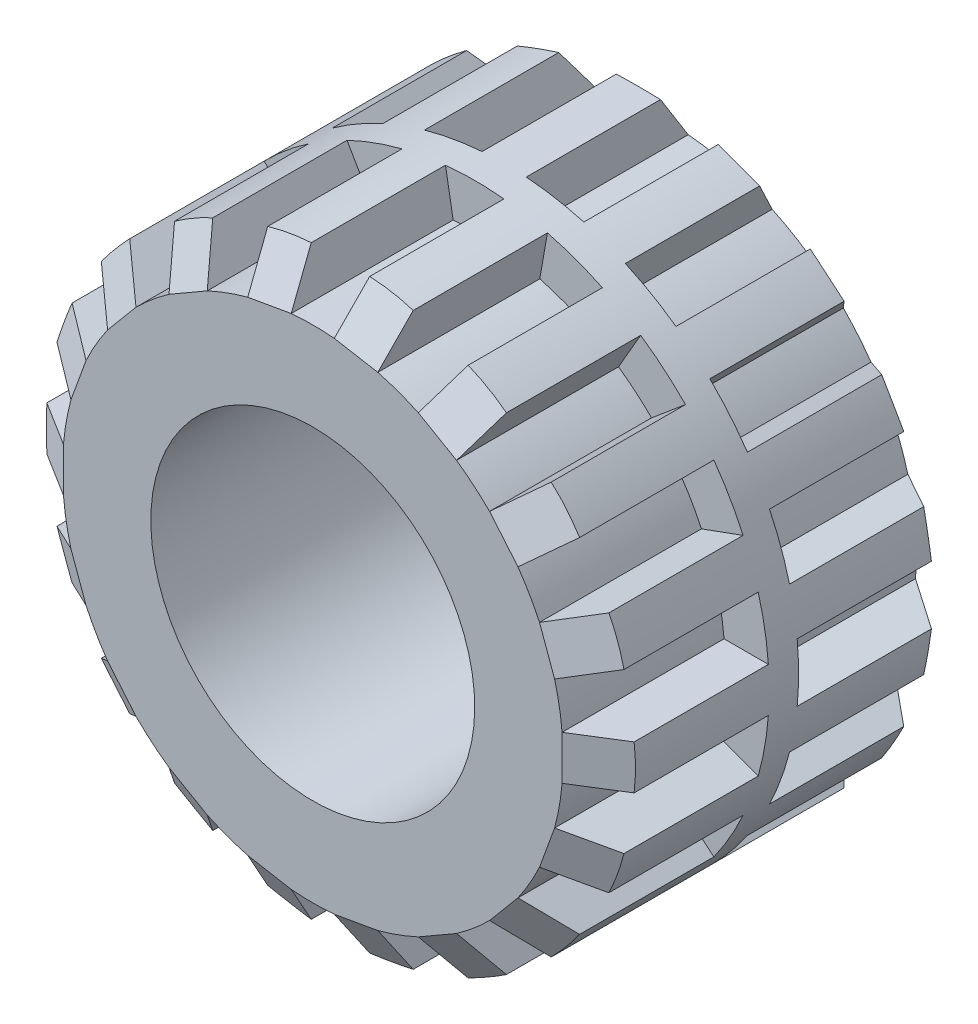
from build123d import *

# Parameters (mm, degrees)
SKETCH1_R             = 8.5
SKETCH1_R_2           = 5.5
BOSS_EXTRUDE1_DEPTH   = 6
SKETCH3_R             = 10
SKETCH3_R_2           = 8.5
BOSS_EXTRUDE3_DEPTH   = 0.5
BOSS_EXTRUDE4_DEPTH   = 5.5
CUT_EXTRUDE1_DEPTH    = 1.5
CIRPATTERN1_COUNT     = 18
MIRROR1_COPY_1_DEPTH  = 5.5
MIRROR1_COPY_2_DEPTH  = 5.5
MIRROR1_COPY_3_DEPTH  = 5.5
MIRROR1_COPY_4_DEPTH  = 5.5
MIRROR1_COPY_5_DEPTH  = 5.5
MIRROR1_COPY_6_DEPTH  = 5.5
MIRROR1_COPY_7_DEPTH  = 5.5
MIRROR1_COPY_8_DEPTH  = 5.5
MIRROR1_COPY_9_DEPTH  = 5.5
MIRROR1_COPY_10_DEPTH = 5.5
MIRROR1_COPY_11_DEPTH = 5.5
MIRROR1_COPY_12_DEPTH = 5.5
MIRROR1_COPY_13_DEPTH = 5.5
MIRROR1_COPY_14_DEPTH = 5.5
MIRROR1_COPY_15_DEPTH = 5.5
MIRROR1_COPY_16_DEPTH = 5.5
MIRROR1_COPY_17_DEPTH = 5.5
MIRROR1_COPY_18_DEPTH = 1.5
MIRROR1_COPY_19_DEPTH = 1.5
MIRROR1_COPY_20_DEPTH = 1.5
MIRROR1_COPY_21_DEPTH = 1.5
MIRROR1_COPY_22_DEPTH = 1.5
MIRROR1_COPY_23_DEPTH = 1.5
MIRROR1_COPY_24_DEPTH = 1.5
MIRROR1_COPY_25_DEPTH = 1.5
MIRROR1_COPY_26_DEPTH = 1.5
MIRROR1_COPY_27_DEPTH = 1.5
MIRROR1_COPY_28_DEPTH = 1.5
MIRROR1_COPY_29_DEPTH = 1.5
MIRROR1_COPY_30_DEPTH = 1.5
MIRROR1_COPY_31_DEPTH = 1.5
MIRROR1_COPY_32_DEPTH = 1.5
MIRROR1_COPY_33_DEPTH = 1.5
MIRROR1_COPY_34_DEPTH = 1.5
BODY_MOVE_COPY1_ANGLE = 10


with BuildPart() as part:
    # Sketch1 → Boss-Extrude1 (new, symmetric)
    with BuildSketch(Plane.XY):
        Circle(SKETCH1_R)
        Circle(SKETCH1_R_2, mode=Mode.SUBTRACT)
    extrude(amount=BOSS_EXTRUDE1_DEPTH, both=True)

    # Sketch3 → Boss-Extrude3 (add, symmetric)
    with BuildSketch(Plane.XY):
        Circle(SKETCH3_R)
        Circle(SKETCH3_R_2, mode=Mode.SUBTRACT)
    extrude(amount=BOSS_EXTRUDE3_DEPTH, both=True)

    # Sketch4 → Boss-Extrude4 (add)
    with BuildSketch(Plane(origin=(0, 0, -0.5), x_dir=(-1, 0, 0), z_dir=(0, 0, -1))):
        with BuildLine():
            Line((-0.75, 8.466847111), (-0.75, 9.971835338))
            ThreePointArc((-0.75, 9.971835338), (0, 10), (0.75, 9.971835338))
            Line((0.75, 9.971835338), (0.75, 8.466847111))
            ThreePointArc((0.75, 8.466847111), (0, 8.5), (-0.75, 8.466847111))
        make_face()
    boss_extrude4 = extrude(amount=BOSS_EXTRUDE4_DEPTH)

    # Sketch5 → Cut-Extrude1 (cut)
    with BuildSketch(Plane.ZY.offset(0.75)):
        Polygon((-6, 8.466847111), (-5, 10.066847111), (-6, 10.066847111), align=None)
    cut_extrude1 = extrude(amount=-CUT_EXTRUDE1_DEPTH, mode=Mode.SUBTRACT)

    # CirPattern1: Boss-Extrude4, Cut-Extrude1 ×18 about axis
    cirpattern1_axis = Axis((0, 0, 0), (0, 0, 1))
    add([boss_extrude4.rotate(cirpattern1_axis, i * 360 / CIRPATTERN1_COUNT) for i in range(1, CIRPATTERN1_COUNT)])
    add([cut_extrude1.rotate(cirpattern1_axis, i * 360 / CIRPATTERN1_COUNT) for i in range(1, CIRPATTERN1_COUNT)], mode=Mode.SUBTRACT)

    # Mirror1: Boss-Extrude4, Cut-Extrude1 across plane
    add(boss_extrude4.mirror(Plane.XY))
    add(cut_extrude1.mirror(Plane.XY), mode=Mode.SUBTRACT)

    # Mirror1 copy 1 sketch → Mirror1 copy 1 (add)
    with BuildSketch(Plane(origin=(0, 0, 0.5), x_dir=(-0.9396926207859084, -0.3420201433256687, 0), z_dir=(0, 0, 1))):
        with BuildLine():
            Line((-0.75, -8.466847111), (-0.75, -9.971835338))
            ThreePointArc((-0.75, -9.971835338), (0, -10), (0.75, -9.971835338))
            Line((0.75, -9.971835338), (0.75, -8.466847111))
            ThreePointArc((0.75, -8.466847111), (0, -8.5), (-0.75, -8.466847111))
        make_face()
    extrude(amount=MIRROR1_COPY_1_DEPTH)

    # Mirror1 copy 2 sketch → Mirror1 copy 2 (add)
    with BuildSketch(Plane(origin=(0, 0, 0.5), x_dir=(-0.766044443118978, -0.6427876096865393, 0), z_dir=(0, 0, 1))):
        with BuildLine():
            Line((-0.75, -8.466847111), (-0.75, -9.971835338))
            ThreePointArc((-0.75, -9.971835338), (0, -10), (0.75, -9.971835338))
            Line((0.75, -9.971835338), (0.75, -8.466847111))
            ThreePointArc((0.75, -8.466847111), (0, -8.5), (-0.75, -8.466847111))
        make_face()
    extrude(amount=MIRROR1_COPY_2_DEPTH)

    # Mirror1 copy 3 sketch → Mirror1 copy 3 (add)
    with BuildSketch(Plane(origin=(0, 0, 0.5), x_dir=(-0.5000000000000001, -0.8660254037844386, 0), z_dir=(0, 0, 1))):
        with BuildLine():
            Line((-0.75, -8.466847111), (-0.75, -9.971835338))
            ThreePointArc((-0.75, -9.971835338), (0, -10), (0.75, -9.971835338))
            Line((0.75, -9.971835338), (0.75, -8.466847111))
            ThreePointArc((0.75, -8.466847111), (0, -8.5), (-0.75, -8.466847111))
        make_face()
    extrude(amount=MIRROR1_COPY_3_DEPTH)

    # Mirror1 copy 4 sketch → Mirror1 copy 4 (add)
    with BuildSketch(Plane(origin=(0, 0, 0.5), x_dir=(-0.17364817766693041, -0.984807753012208, 0), z_dir=(0, 0, 1))):
        with BuildLine():
            Line((-0.75, -8.466847111), (-0.75, -9.971835338))
            ThreePointArc((-0.75, -9.971835338), (0, -10), (0.75, -9.971835338))
            Line((0.75, -9.971835338), (0.75, -8.466847111))
            ThreePointArc((0.75, -8.466847111), (0, -8.5), (-0.75, -8.466847111))
        make_face()
    extrude(amount=MIRROR1_COPY_4_DEPTH)

    # Mirror1 copy 5 sketch → Mirror1 copy 5 (add)
    with BuildSketch(Plane(origin=(0, 0, 0.5), x_dir=(0.1736481776669303, -0.984807753012208, 0), z_dir=(0, 0, 1))):
        with BuildLine():
            Line((-0.75, -8.466847111), (-0.75, -9.971835338))
            ThreePointArc((-0.75, -9.971835338), (0, -10), (0.75, -9.971835338))
            Line((0.75, -9.971835338), (0.75, -8.466847111))
            ThreePointArc((0.75, -8.466847111), (0, -8.5), (-0.75, -8.466847111))
        make_face()
    extrude(amount=MIRROR1_COPY_5_DEPTH)

    # Mirror1 copy 6 sketch → Mirror1 copy 6 (add)
    with BuildSketch(Plane(origin=(0, 0, 0.5), x_dir=(0.4999999999999998, -0.8660254037844387, 0), z_dir=(0, 0, 1))):
        with BuildLine():
            Line((-0.75, -8.466847111), (-0.75, -9.971835338))
            ThreePointArc((-0.75, -9.971835338), (0, -10), (0.75, -9.971835338))
            Line((0.75, -9.971835338), (0.75, -8.466847111))
            ThreePointArc((0.75, -8.466847111), (0, -8.5), (-0.75, -8.466847111))
        make_face()
    extrude(amount=MIRROR1_COPY_6_DEPTH)

    # Mirror1 copy 7 sketch → Mirror1 copy 7 (add)
    with BuildSketch(Plane(origin=(0, 0, 0.5), x_dir=(0.7660444431189779, -0.6427876096865395, 0), z_dir=(0, 0, 1))):
        with BuildLine():
            Line((-0.75, -8.466847111), (-0.75, -9.971835338))
            ThreePointArc((-0.75, -9.971835338), (0, -10), (0.75, -9.971835338))
            Line((0.75, -9.971835338), (0.75, -8.466847111))
            ThreePointArc((0.75, -8.466847111), (0, -8.5), (-0.75, -8.466847111))
        make_face()
    extrude(amount=MIRROR1_COPY_7_DEPTH)

    # Mirror1 copy 8 sketch → Mirror1 copy 8 (add)
    with BuildSketch(Plane(origin=(0, 0, 0.5), x_dir=(0.9396926207859083, -0.3420201433256689, 0), z_dir=(0, 0, 1))):
        with BuildLine():
            Line((-0.75, -8.466847111), (-0.75, -9.971835338))
            ThreePointArc((-0.75, -9.971835338), (0, -10), (0.75, -9.971835338))
            Line((0.75, -9.971835338), (0.75, -8.466847111))
            ThreePointArc((0.75, -8.466847111), (0, -8.5), (-0.75, -8.466847111))
        make_face()
    extrude(amount=MIRROR1_COPY_8_DEPTH)

    # Mirror1 copy 9 sketch → Mirror1 copy 9 (add)
    with BuildSketch(Plane.XY.offset(0.5)):
        with BuildLine():
            Line((-0.75, -8.466847111), (-0.75, -9.971835338))
            ThreePointArc((-0.75, -9.971835338), (0, -10), (0.75, -9.971835338))
            Line((0.75, -9.971835338), (0.75, -8.466847111))
            ThreePointArc((0.75, -8.466847111), (0, -8.5), (-0.75, -8.466847111))
        make_face()
    extrude(amount=MIRROR1_COPY_9_DEPTH)

    # Mirror1 copy 10 sketch → Mirror1 copy 10 (add)
    with BuildSketch(Plane(origin=(0, 0, 0.5), x_dir=(0.9396926207859084, 0.34202014332566866, 0), z_dir=(0, 0, 1))):
        with BuildLine():
            Line((-0.75, -8.466847111), (-0.75, -9.971835338))
            ThreePointArc((-0.75, -9.971835338), (0, -10), (0.75, -9.971835338))
            Line((0.75, -9.971835338), (0.75, -8.466847111))
            ThreePointArc((0.75, -8.466847111), (0, -8.5), (-0.75, -8.466847111))
        make_face()
    extrude(amount=MIRROR1_COPY_10_DEPTH)

    # Mirror1 copy 11 sketch → Mirror1 copy 11 (add)
    with BuildSketch(Plane(origin=(0, 0, 0.5), x_dir=(0.766044443118978, 0.6427876096865393, 0), z_dir=(0, 0, 1))):
        with BuildLine():
            Line((-0.75, -8.466847111), (-0.75, -9.971835338))
            ThreePointArc((-0.75, -9.971835338), (0, -10), (0.75, -9.971835338))
            Line((0.75, -9.971835338), (0.75, -8.466847111))
            ThreePointArc((0.75, -8.466847111), (0, -8.5), (-0.75, -8.466847111))
        make_face()
    extrude(amount=MIRROR1_COPY_11_DEPTH)

    # Mirror1 copy 12 sketch → Mirror1 copy 12 (add)
    with BuildSketch(Plane(origin=(0, 0, 0.5), x_dir=(0.5000000000000004, 0.8660254037844384, 0), z_dir=(0, 0, 1))):
        with BuildLine():
            Line((-0.75, -8.466847111), (-0.75, -9.971835338))
            ThreePointArc((-0.75, -9.971835338), (0, -10), (0.75, -9.971835338))
            Line((0.75, -9.971835338), (0.75, -8.466847111))
            ThreePointArc((0.75, -8.466847111), (0, -8.5), (-0.75, -8.466847111))
        make_face()
    extrude(amount=MIRROR1_COPY_12_DEPTH)

    # Mirror1 copy 13 sketch → Mirror1 copy 13 (add)
    with BuildSketch(Plane(origin=(0, 0, 0.5), x_dir=(0.17364817766693033, 0.984807753012208, 0), z_dir=(0, 0, 1))):
        with BuildLine():
            Line((-0.75, -8.466847111), (-0.75, -9.971835338))
            ThreePointArc((-0.75, -9.971835338), (0, -10), (0.75, -9.971835338))
            Line((0.75, -9.971835338), (0.75, -8.466847111))
            ThreePointArc((0.75, -8.466847111), (0, -8.5), (-0.75, -8.466847111))
        make_face()
    extrude(amount=MIRROR1_COPY_13_DEPTH)

    # Mirror1 copy 14 sketch → Mirror1 copy 14 (add)
    with BuildSketch(Plane(origin=(0, 0, 0.5), x_dir=(-0.17364817766692997, 0.9848077530122081, 0), z_dir=(0, 0, 1))):
        with BuildLine():
            Line((-0.75, -8.466847111), (-0.75, -9.971835338))
            ThreePointArc((-0.75, -9.971835338), (0, -10), (0.75, -9.971835338))
            Line((0.75, -9.971835338), (0.75, -8.466847111))
            ThreePointArc((0.75, -8.466847111), (0, -8.5), (-0.75, -8.466847111))
        make_face()
    extrude(amount=MIRROR1_COPY_14_DEPTH)

    # Mirror1 copy 15 sketch → Mirror1 copy 15 (add)
    with BuildSketch(Plane(origin=(0, 0, 0.5), x_dir=(-0.5000000000000001, 0.8660254037844386, 0), z_dir=(0, 0, 1))):
        with BuildLine():
            Line((-0.75, -8.466847111), (-0.75, -9.971835338))
            ThreePointArc((-0.75, -9.971835338), (0, -10), (0.75, -9.971835338))
            Line((0.75, -9.971835338), (0.75, -8.466847111))
            ThreePointArc((0.75, -8.466847111), (0, -8.5), (-0.75, -8.466847111))
        make_face()
    extrude(amount=MIRROR1_COPY_15_DEPTH)

    # Mirror1 copy 16 sketch → Mirror1 copy 16 (add)
    with BuildSketch(Plane(origin=(0, 0, 0.5), x_dir=(-0.7660444431189778, 0.6427876096865396, 0), z_dir=(0, 0, 1))):
        with BuildLine():
            Line((-0.75, -8.466847111), (-0.75, -9.971835338))
            ThreePointArc((-0.75, -9.971835338), (0, -10), (0.75, -9.971835338))
            Line((0.75, -9.971835338), (0.75, -8.466847111))
            ThreePointArc((0.75, -8.466847111), (0, -8.5), (-0.75, -8.466847111))
        make_face()
    extrude(amount=MIRROR1_COPY_16_DEPTH)

    # Mirror1 copy 17 sketch → Mirror1 copy 17 (add)
    with BuildSketch(Plane(origin=(0, 0, 0.5), x_dir=(-0.9396926207859084, 0.3420201433256686, 0), z_dir=(0, 0, 1))):
        with BuildLine():
            Line((-0.75, -8.466847111), (-0.75, -9.971835338))
            ThreePointArc((-0.75, -9.971835338), (0, -10), (0.75, -9.971835338))
            Line((0.75, -9.971835338), (0.75, -8.466847111))
            ThreePointArc((0.75, -8.466847111), (0, -8.5), (-0.75, -8.466847111))
        make_face()
    extrude(amount=MIRROR1_COPY_17_DEPTH)

    # Mirror1 copy 18 sketch → Mirror1 copy 18 (cut)
    with BuildSketch(Plane(origin=(-0.704769466, -0.256515107, 0), x_dir=(0, 0, -1), z_dir=(-0.9396926207859084, -0.3420201433256687, 0))):
        Polygon((-6, -8.466847111), (-5, -10.066847111), (-6, -10.066847111), align=None)
    extrude(amount=-MIRROR1_COPY_18_DEPTH, mode=Mode.SUBTRACT)

    # Mirror1 copy 19 sketch → Mirror1 copy 19 (cut)
    with BuildSketch(Plane(origin=(-0.574533332, -0.482090707, 0), x_dir=(0, 0, -1), z_dir=(-0.766044443118978, -0.6427876096865393, 0))):
        Polygon((-6, -8.466847111), (-5, -10.066847111), (-6, -10.066847111), align=None)
    extrude(amount=-MIRROR1_COPY_19_DEPTH, mode=Mode.SUBTRACT)

    # Mirror1 copy 20 sketch → Mirror1 copy 20 (cut)
    with BuildSketch(Plane(origin=(-0.375, -0.649519053, 0), x_dir=(0, 0, -1), z_dir=(-0.5000000000000001, -0.8660254037844386, 0))):
        Polygon((-6, -8.466847111), (-5, -10.066847111), (-6, -10.066847111), align=None)
    extrude(amount=-MIRROR1_COPY_20_DEPTH, mode=Mode.SUBTRACT)

    # Mirror1 copy 21 sketch → Mirror1 copy 21 (cut)
    with BuildSketch(Plane(origin=(-0.130236133, -0.738605815, 0), x_dir=(0, 0, -1), z_dir=(-0.17364817766693041, -0.984807753012208, 0))):
        Polygon((-6, -8.466847111), (-5, -10.066847111), (-6, -10.066847111), align=None)
    extrude(amount=-MIRROR1_COPY_21_DEPTH, mode=Mode.SUBTRACT)

    # Mirror1 copy 22 sketch → Mirror1 copy 22 (cut)
    with BuildSketch(Plane(origin=(0.130236133, -0.738605815, 0), x_dir=(0, 0, -1), z_dir=(0.1736481776669303, -0.984807753012208, 0))):
        Polygon((-6, -8.466847111), (-5, -10.066847111), (-6, -10.066847111), align=None)
    extrude(amount=-MIRROR1_COPY_22_DEPTH, mode=Mode.SUBTRACT)

    # Mirror1 copy 23 sketch → Mirror1 copy 23 (cut)
    with BuildSketch(Plane(origin=(0.375, -0.649519053, 0), x_dir=(0, 0, -1), z_dir=(0.4999999999999998, -0.8660254037844387, 0))):
        Polygon((-6, -8.466847111), (-5, -10.066847111), (-6, -10.066847111), align=None)
    extrude(amount=-MIRROR1_COPY_23_DEPTH, mode=Mode.SUBTRACT)

    # Mirror1 copy 24 sketch → Mirror1 copy 24 (cut)
    with BuildSketch(Plane(origin=(0.574533332, -0.482090707, 0), x_dir=(0, 0, -1), z_dir=(0.7660444431189779, -0.6427876096865395, 0))):
        Polygon((-6, -8.466847111), (-5, -10.066847111), (-6, -10.066847111), align=None)
    extrude(amount=-MIRROR1_COPY_24_DEPTH, mode=Mode.SUBTRACT)

    # Mirror1 copy 25 sketch → Mirror1 copy 25 (cut)
    with BuildSketch(Plane(origin=(0.704769466, -0.256515107, 0), x_dir=(0, 0, -1), z_dir=(0.9396926207859083, -0.3420201433256689, 0))):
        Polygon((-6, -8.466847111), (-5, -10.066847111), (-6, -10.066847111), align=None)
    extrude(amount=-MIRROR1_COPY_25_DEPTH, mode=Mode.SUBTRACT)

    # Mirror1 copy 26 sketch → Mirror1 copy 26 (cut)
    with BuildSketch(Plane(origin=(0.75, 0, 0), x_dir=(0, 0, -1), z_dir=(1, 0, 0))):
        Polygon((-6, -8.466847111), (-5, -10.066847111), (-6, -10.066847111), align=None)
    extrude(amount=-MIRROR1_COPY_26_DEPTH, mode=Mode.SUBTRACT)

    # Mirror1 copy 27 sketch → Mirror1 copy 27 (cut)
    with BuildSketch(Plane(origin=(0.704769466, 0.256515107, 0), x_dir=(0, 0, -1), z_dir=(0.9396926207859084, 0.34202014332566866, 0))):
        Polygon((-6, -8.466847111), (-5, -10.066847111), (-6, -10.066847111), align=None)
    extrude(amount=-MIRROR1_COPY_27_DEPTH, mode=Mode.SUBTRACT)

    # Mirror1 copy 28 sketch → Mirror1 copy 28 (cut)
    with BuildSketch(Plane(origin=(0.574533332, 0.482090707, 0), x_dir=(0, 0, -1), z_dir=(0.766044443118978, 0.6427876096865393, 0))):
        Polygon((-6, -8.466847111), (-5, -10.066847111), (-6, -10.066847111), align=None)
    extrude(amount=-MIRROR1_COPY_28_DEPTH, mode=Mode.SUBTRACT)

    # Mirror1 copy 29 sketch → Mirror1 copy 29 (cut)
    with BuildSketch(Plane(origin=(0.375, 0.649519053, 0), x_dir=(0, 0, -1), z_dir=(0.5000000000000004, 0.8660254037844384, 0))):
        Polygon((-6, -8.466847111), (-5, -10.066847111), (-6, -10.066847111), align=None)
    extrude(amount=-MIRROR1_COPY_29_DEPTH, mode=Mode.SUBTRACT)

    # Mirror1 copy 30 sketch → Mirror1 copy 30 (cut)
    with BuildSketch(Plane(origin=(0.130236133, 0.738605815, 0), x_dir=(0, 0, -1), z_dir=(0.17364817766693033, 0.984807753012208, 0))):
        Polygon((-6, -8.466847111), (-5, -10.066847111), (-6, -10.066847111), align=None)
    extrude(amount=-MIRROR1_COPY_30_DEPTH, mode=Mode.SUBTRACT)

    # Mirror1 copy 31 sketch → Mirror1 copy 31 (cut)
    with BuildSketch(Plane(origin=(-0.130236133, 0.738605815, 0), x_dir=(0, 0, -1), z_dir=(-0.17364817766692997, 0.9848077530122081, 0))):
        Polygon((-6, -8.466847111), (-5, -10.066847111), (-6, -10.066847111), align=None)
    extrude(amount=-MIRROR1_COPY_31_DEPTH, mode=Mode.SUBTRACT)

    # Mirror1 copy 32 sketch → Mirror1 copy 32 (cut)
    with BuildSketch(Plane(origin=(-0.375, 0.649519053, 0), x_dir=(0, 0, -1), z_dir=(-0.5000000000000001, 0.8660254037844386, 0))):
        Polygon((-6, -8.466847111), (-5, -10.066847111), (-6, -10.066847111), align=None)
    extrude(amount=-MIRROR1_COPY_32_DEPTH, mode=Mode.SUBTRACT)

    # Mirror1 copy 33 sketch → Mirror1 copy 33 (cut)
    with BuildSketch(Plane(origin=(-0.574533332, 0.482090707, 0), x_dir=(0, 0, -1), z_dir=(-0.7660444431189778, 0.6427876096865396, 0))):
        Polygon((-6, -8.466847111), (-5, -10.066847111), (-6, -10.066847111), align=None)
    extrude(amount=-MIRROR1_COPY_33_DEPTH, mode=Mode.SUBTRACT)

    # Mirror1 copy 34 sketch → Mirror1 copy 34 (cut)
    with BuildSketch(Plane(origin=(-0.704769466, 0.256515107, 0), x_dir=(0, 0, -1), z_dir=(-0.9396926207859084, 0.3420201433256686, 0))):
        Polygon((-6, -8.466847111), (-5, -10.066847111), (-6, -10.066847111), align=None)
    extrude(amount=-MIRROR1_COPY_34_DEPTH, mode=Mode.SUBTRACT)


with BuildPart() as body_2:
    # Split1: the piece on the far side of the plane
    add(part.part)
    split(bisect_by=Plane.XY, keep=Keep.BOTTOM)


with BuildPart() as part_1:
    add(part.part)

    # Split1
    split(bisect_by=Plane.XY, keep=Keep.TOP)


with BuildPart() as part_2:
    # Body-Move/Copy1: moved
    add(part_1.part.rotate(Axis((0, 0, 0), (0, 0, 1)), BODY_MOVE_COPY1_ANGLE))


with BuildPart() as body_2_1:
    add(body_2.part)

    # Combine1: union part
    add(part_2.part)


solid = body_2_1.part
